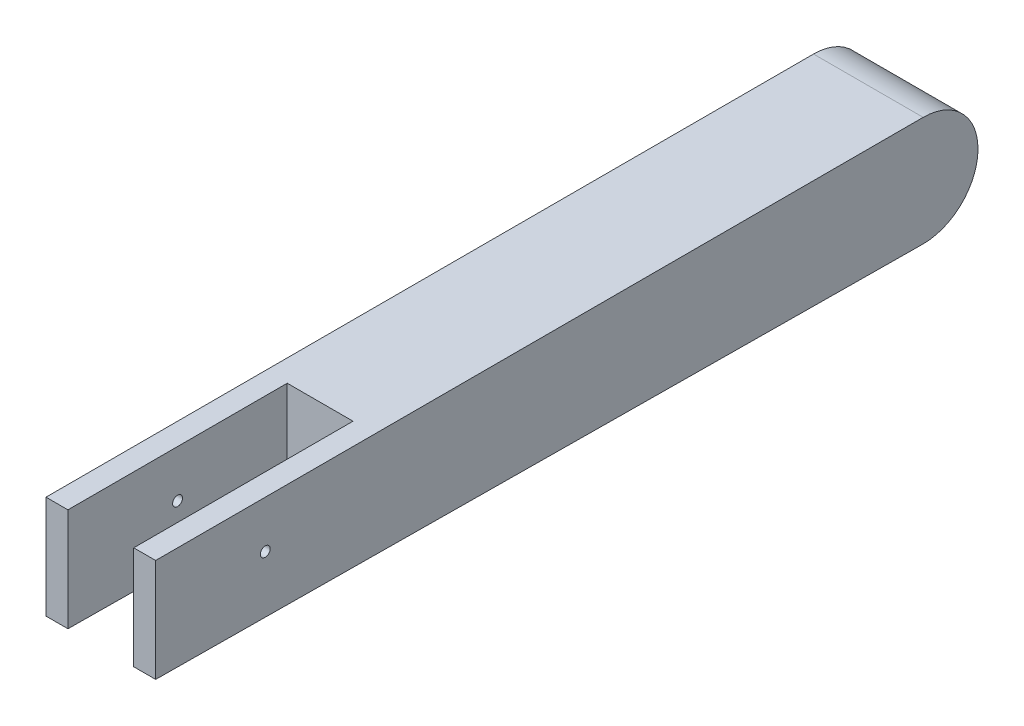
from build123d import *

# Parameters (mm, degrees)
BOSS_EXTRUDE1_DEPTH = 50
SKETCH6_W           = 30
SKETCH6_H           = 100
CUT_EXTRUDE3_DEPTH  = 222.479310794
SKETCH5_R           = 2.25
CUT_EXTRUDE2_DEPTH  = 219.649468957


with BuildPart() as part:
    # Sketch1 → Boss-Extrude1 (new body)
    with BuildSketch(Plane(origin=(0, 0, 0), x_dir=(0, 0, -1), z_dir=(1, 0, 0))):
        with BuildLine():
            Line((140.111731844, 35.418994413), (-209.888268156, 35.418994413))
            Line((-209.888268156, 35.418994413), (-209.888268156, 13.43575419))
            Line((-209.888268156, 13.43575419), (-209.888268156, -11.56424581))
            Line((-209.888268156, -11.56424581), (139.680798176, -14.577291234))
            ThreePointArc((139.680798176, -14.577291234), (115.112660449, 10.634469251), (140.111731844, 35.418994413))
        make_face()
        with BuildLine():
            Line((140.111731844, -14.581005587), (140.111731844, 35.418994413))
            ThreePointArc((140.111731844, 35.418994413), (115.112660449, 10.634469251), (139.680798176, -14.577291234))
            Line((139.680798176, -14.577291234), (140.111731844, -14.581005587))
        make_face()
        with BuildLine():
            ThreePointArc((165.111731844, 10.418994413), (157.789401373, 28.096663943), (140.111731844, 35.418994413))
            Line((140.111731844, 35.418994413), (140.111731844, -14.581005587))
            ThreePointArc((140.111731844, -14.581005587), (157.789401373, -7.258675116), (165.111731844, 10.418994413))
        make_face()
    extrude(amount=BOSS_EXTRUDE1_DEPTH)

    # Sketch6 → Cut-Extrude3 (cut, through all)
    with BuildSketch(Plane(origin=(0, 35.418994413, 0), x_dir=(1, 0, 0), z_dir=(0, 1, 0))):
        with Locations((25, -159.888268156)):
            Rectangle(SKETCH6_W, SKETCH6_H)
    extrude(amount=-CUT_EXTRUDE3_DEPTH, mode=Mode.SUBTRACT)

    # Sketch5 → Cut-Extrude2 (cut, through all)
    with BuildSketch(Plane(origin=(50, 0, 0), x_dir=(0, 0, -1), z_dir=(1, 0, 0))):
        with Locations((-159.888268156, 13.945126907)):
            Circle(SKETCH5_R)
    extrude(amount=-CUT_EXTRUDE2_DEPTH, mode=Mode.SUBTRACT)


solid = part.part
